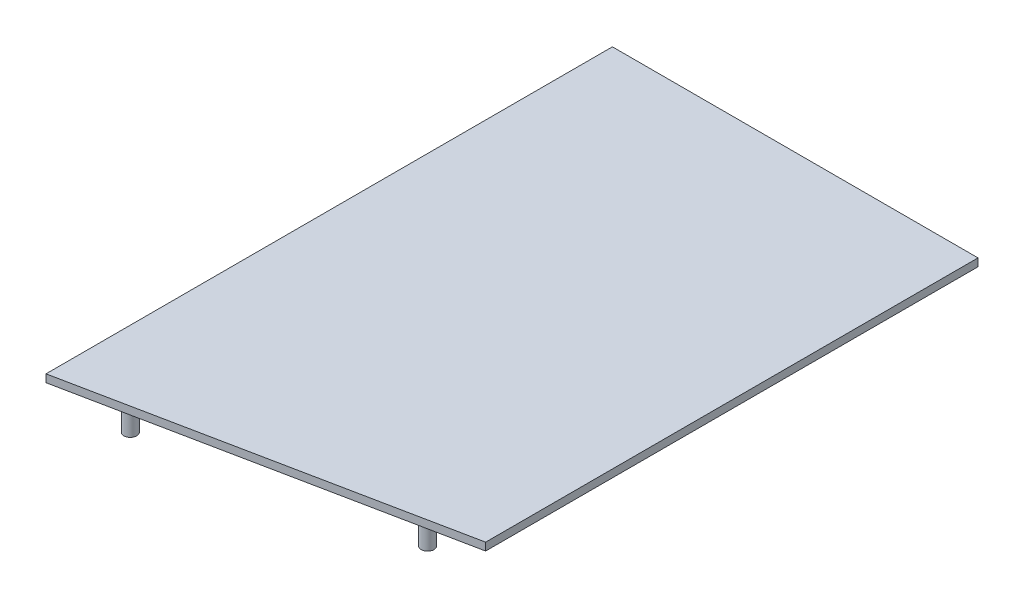
from build123d import *

# Parameters (mm, degrees)
BOSS_EXTRUDE1_DEPTH = 1.5
SKETCH2_R           = 1.25
SKETCH2_W           = 2.5
SKETCH2_H           = 2.5
BOSS_EXTRUDE2_DEPTH = 6.5
CUT_EXTRUDE1_DEPTH  = 0.6


with BuildPart() as part:
    # Sketch1 → Boss-Extrude1 (new body)
    with BuildSketch(Plane(origin=(0, 0, 0), x_dir=(1, 0, 0), z_dir=(0, 1, 0))):
        Polygon((0, 0), (71, 14.38), (71, 110), (0, 110), align=None)
    extrude(amount=BOSS_EXTRUDE1_DEPTH)

    # Sketch2 → Boss-Extrude2 (add)
    with BuildSketch(Plane(origin=(0, 1.5, 0), x_dir=(1, 0, 0), z_dir=(0, 1, 0))):
        with Locations(Location((11.5, 4.879915247, 0), (0, 0, 270))):
            Circle(SKETCH2_R)
        with Locations(Location((59.5, 14.601605388, 0), (0, 0, 270))):
            Circle(SKETCH2_R)
        with Locations((11.25, 107.5)):
            Rectangle(SKETCH2_W, SKETCH2_H)
    extrude(amount=-BOSS_EXTRUDE2_DEPTH)

    # Sketch3 → Cut-Extrude1 (cut)
    with BuildSketch(Plane(origin=(0, 0, 0), x_dir=(-1, 0, 0), z_dir=(0, -1, 0))):
        Polygon((-66, 105), (-66, 18.468844579), (-5, 6.114196692), (-5, 105), align=None)
    extrude(amount=-CUT_EXTRUDE1_DEPTH, mode=Mode.SUBTRACT)


solid = part.part
